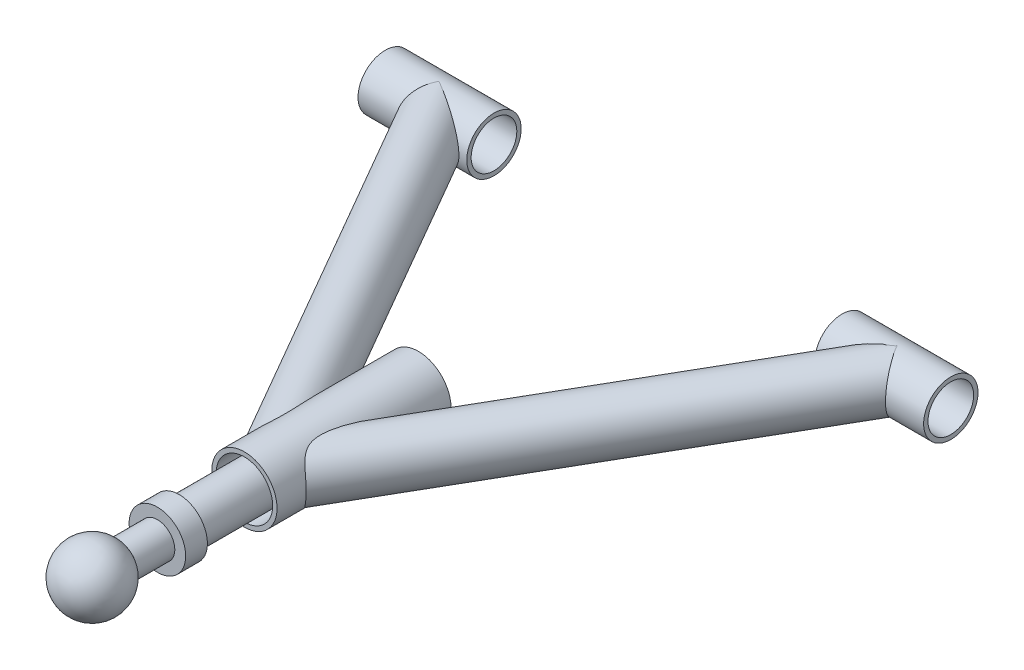
from build123d import *

# Parameters (mm, degrees)
SKETCH_1_R                       = 15
SKETCH_1_R_2                     = 13
EXTRUDE_1_DEPTH                  = 80
EXTRUDE_START                    = 80
SKETCH_3_R                       = 12.5
SKETCH_3_R_2                     = 10.5
EXTRUDE_3_DEPTH                  = 50
EXTRUDE_2_REACH                  = 184.52
EXTRUDE_2_END_RADIUS             = 15
SKETCH_2_R                       = 12.5
SKETCH_2_R_2                     = 10.5
EXTRUDE_2_DIRECTION_2_REACH      = 184.52
EXTRUDE_2_DIRECTION_2_END_RADIUS = 12.5


with BuildPart() as part:
    # 草图1 → 凸台-拉伸1 (new body)
    with BuildSketch(Plane.XY):
        Circle(SKETCH_1_R)
        Circle(SKETCH_1_R_2, mode=Mode.SUBTRACT)
    extrude(amount=EXTRUDE_1_DEPTH)

    # 凸台-拉伸2: up to this cylinder (the profile starts outside it)
    extrude_2_end = Plane(origin=(0, 0, 10.827115), z_dir=(0, 0, -1)) * Cylinder(EXTRUDE_2_END_RADIUS, 400.04, mode=Mode.PRIVATE)
    # 草图2 → 凸台-拉伸2 (add, up to the surface)
    with BuildSketch(Plane(origin=(0, 0, 0), x_dir=(0, -1, 0), z_dir=(-0.500000000000001, 0, 0.866025403784438)), mode=Mode.PRIVATE) as extrude_2_sk1:
        with Locations(Location((0, 33.80067686, 0), (0, 0, 90))):
            Circle(SKETCH_2_R)
        with Locations(Location((0, 33.80067686, 0), (0, 0, 90))):
            Circle(SKETCH_2_R_2, mode=Mode.SUBTRACT)
    extrude_2_tool1 = extrude(extrude_2_sk1.sketch, amount=EXTRUDE_2_REACH, mode=Mode.PRIVATE) - extrude_2_end
    extrude_2 = extrude_2_tool1.solids().sort_by_distance((18.753113, 0, 10.827115))[0]
    add(extrude_2)

    # 凸台-拉伸2 direction 2: up to this cylinder (the profile starts outside it)
    extrude_2_direction_2_end = Plane(origin=(18.753113, 0, -114.734351253), z_dir=(-1, 0, 0)) * Cylinder(EXTRUDE_2_DIRECTION_2_END_RADIUS, 395.04, mode=Mode.PRIVATE)
    # 草图2 → 凸台-拉伸2 direction 2 (add, up to the surface)
    with BuildSketch(Plane(origin=(0, 0, 0), x_dir=(0, -1, 0), z_dir=(-0.500000000000001, 0, 0.866025403784438)), mode=Mode.PRIVATE) as extrude_2_direction_2_sk1:
        with Locations(Location((0, 33.80067686, 0), (0, 0, 90))):
            Circle(SKETCH_2_R)
        with Locations(Location((0, 33.80067686, 0), (0, 0, 90))):
            Circle(SKETCH_2_R_2, mode=Mode.SUBTRACT)
    extrude_2_direction_2_tool1 = extrude(extrude_2_direction_2_sk1.sketch, amount=-EXTRUDE_2_DIRECTION_2_REACH, mode=Mode.PRIVATE) - extrude_2_direction_2_end
    extrude_2_direction_2 = extrude_2_direction_2_tool1.solids().sort_by_distance((18.753113, 0, 10.827115))[0]
    add(extrude_2_direction_2)
    extrude_2 = extrude_2 + extrude_2_direction_2  # both directions under the feature's name, for the pattern or mirror that repeats it


with BuildPart() as body_2:
    # 草图3 → 凸台-拉伸3 (new body)
    with BuildSketch(Plane(origin=(0, 0, 0), x_dir=(0, 0, -1), z_dir=(1, 0, 0)).offset(EXTRUDE_START)):
        with Locations((114.734351253, 0)):
            Circle(SKETCH_3_R)
        with Locations((114.734351253, 0)):
            Circle(SKETCH_3_R_2, mode=Mode.SUBTRACT)
    extrude_3 = extrude(amount=EXTRUDE_3_DEPTH)


with BuildPart() as part_1:
    add(part.part)

    # 镜向14: 凸台-拉伸3, 凸台-拉伸2 across plane
    add(extrude_3.mirror(Plane(origin=(0, 0, 0), x_dir=(0, 0, 1), z_dir=(1, 0, 0))))
    add(extrude_2.mirror(Plane(origin=(0, 0, 0), x_dir=(0, 0, 1), z_dir=(1, 0, 0))))


with BuildPart() as body_3:
    # 草图4 → 旋转1 (revolve)
    with BuildSketch(Plane(origin=(0, 0, 0), x_dir=(1, 0, 0), z_dir=(0, 1, 0))):
        with BuildLine():
            Line((-8, -120), (-8, -137.31142246))
            ThreePointArc((-8, -137.31142246), (-14.410563193, -154.163612428), (0, -165))
            Line((0, -165), (0, -74.750864739))
            Line((0, -74.750864739), (-10, -74.750864739))
            Line((-10, -74.750864739), (-10, -110))
            Line((-10, -110), (-13, -110))
            Line((-13, -110), (-13, -120))
            Line((-13, -120), (-8, -120))
        make_face()
    revolve(axis=Axis((0, 0, 0), (0, 0, 1)))


solid = Compound([body_2.part, part_1.part, body_3.part])
